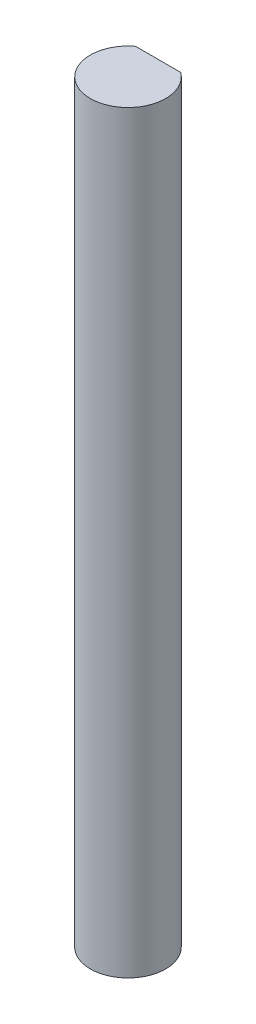
from build123d import *

# Parameters (mm, degrees)
EXTRUDE_1_DEPTH = 50


with BuildPart() as part:
    # 草图1 → 凸台-拉伸1 (new body)
    with BuildSketch(Plane(origin=(0, 0, 0), x_dir=(1, 0, 0), z_dir=(0, 1, 0))):
        with BuildLine():
            Line((0, 2), (-1.5, 2))
            ThreePointArc((-1.5, 2), (-2.371708245, -0.790569415), (0, -2.5))
            Line((0, -2.5), (0, 2))
        make_face()
        with BuildLine():
            Line((1.5, 2), (0, 2))
            Line((0, 2), (0, -2.5))
            ThreePointArc((0, -2.5), (1.767766953, -1.767766953), (2.5, 0))
            ThreePointArc((2.5, 0), (2.236067977, 1.118033989), (1.5, 2))
        make_face()
    extrude(amount=EXTRUDE_1_DEPTH)


solid = part.part
